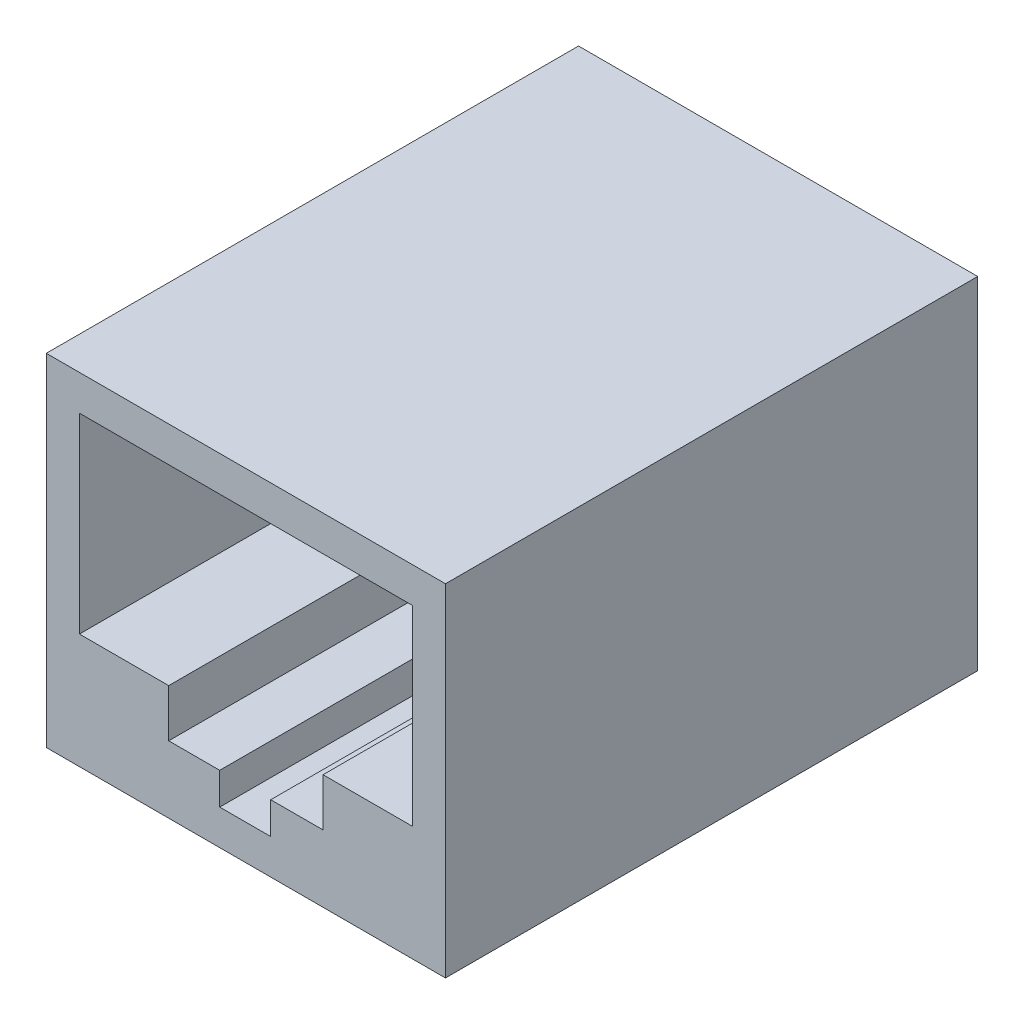
from build123d import *

# Parameters (mm, degrees)
SKETCH1_W           = 15.9
SKETCH1_H           = 13.6
BOSS_EXTRUDE1_DEPTH = 21.2
CUT_EXTRUDE1_DEPTH  = 15.24


with BuildPart() as part:
    # Sketch1 → Boss-Extrude1 (new body)
    with BuildSketch(Plane.XY):
        with Locations((7.95, 6.8)):
            Rectangle(SKETCH1_W, SKETCH1_H)
    extrude(amount=-BOSS_EXTRUDE1_DEPTH)

    # Sketch2 → Cut-Extrude1 (cut)
    with BuildSketch(Plane.XY):
        Polygon((1.32, 12.19437295), (14.58, 12.19437295), (14.58, 4.57437295), (11.024, 4.57437295), (11.024, 2.66937295), (8.94, 2.66937295), (8.94, 1.39937295), (6.908, 1.39937295), (6.908, 2.66937295), (4.876, 2.66937295), (4.876, 4.57437295), (1.32, 4.57437295), align=None)
    extrude(amount=-CUT_EXTRUDE1_DEPTH, mode=Mode.SUBTRACT)


solid = part.part
